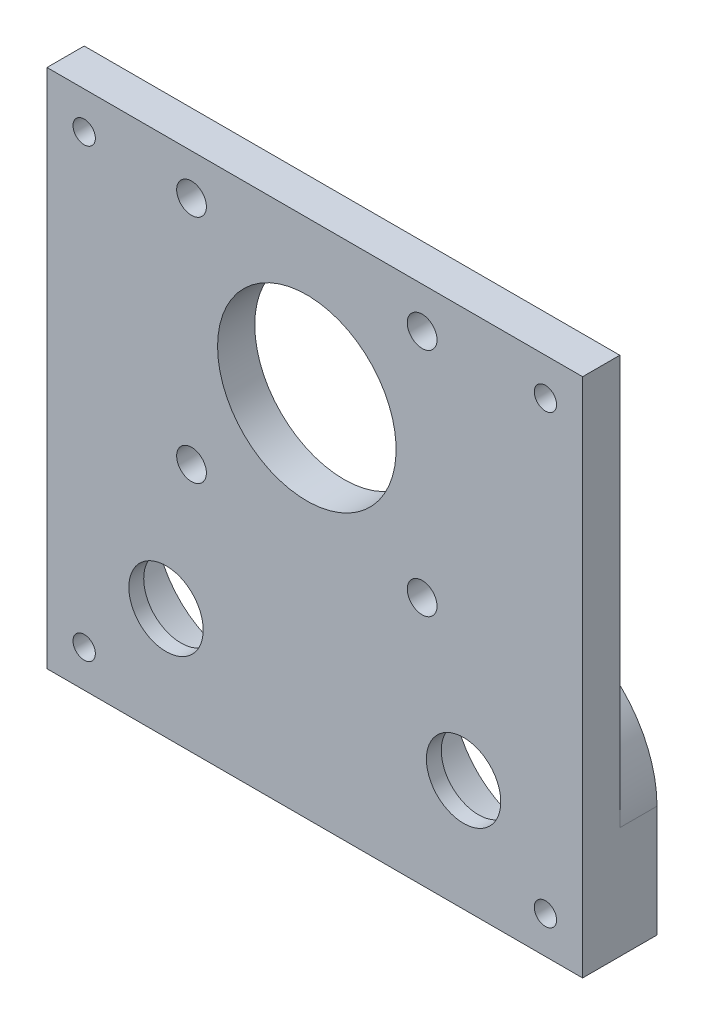
from build123d import *

# Parameters (mm, degrees)
SKETCH1_W               = 70
SKETCH1_H               = 70
BOSS_EXTRUDE1_DEPTH     = 10
SKETCH2_R               = 12
SKETCH2_R_2             = 2
SKETCH2_R_3             = 11.5
CUT_EXTRUDE1_DEPTH      = 10
SKETCH3_W               = 10
SKETCH3_H               = 70
BOSS_EXTRUDE2_DEPTH     = 15
SKETCH4_W               = 10
SKETCH4_H               = 70
BOSS_EXTRUDE3_DEPTH     = 15
SKETCH5_R               = 11.5
SKETCH5_R_2             = 4
BOSS_EXTRUDE4_DEPTH     = 2
SKETCH6_R               = 1.5
SKETCH6_R_2             = 1.648708122
CUT_EXTRUDE3_DEPTH      = 10
BOSS_EXTRUDE5_START     = -10
SKETCH7_R               = 11.986708095
SKETCH7_R_2             = 2
BOSS_EXTRUDE5_DEPTH     = 10
SKETCH8_R               = 12
CUT_EXTRUDE4_DEPTH      = 10
SKETCH9_R               = 2
CUT_EXTRUDE5_DEPTH      = 10
CUT_EXTRUDE7_DEPTH      = 5
SKETCH15_W              = 14
SKETCH15_H              = 70
CUT_EXTRUDE8_DEPTH      = 5
CUT_EXTRUDE9_DEPTH      = 19
CUT_EXTRUDE9_DEPTH_BACK = 48
SKETCH16_R              = 1.5
SKETCH17_R              = 5
CUT_EXTRUDE10_DEPTH     = 19
SKETCH18_R              = 16.289174866
SKETCH18_R_2            = 12
BOSS_EXTRUDE6_DEPTH     = 5


with BuildPart() as part:
    # Sketch1 → Boss-Extrude1 (new body)
    with BuildSketch(Plane.XY):
        with Locations((35, 35)):
            Rectangle(SKETCH1_W, SKETCH1_H)
    extrude(amount=BOSS_EXTRUDE1_DEPTH)

    # Sketch2 → Cut-Extrude1 (cut)
    with BuildSketch(Plane.XY.offset(10)):
        with Locations((35, 49)):
            Circle(SKETCH2_R)
        with Locations((19.5, 65)):
            Circle(SKETCH2_R_2)
        with Locations((50.5, 65)):
            Circle(SKETCH2_R_2)
        with Locations((19.5, 34)):
            Circle(SKETCH2_R_2)
        with Locations((50.5, 34)):
            Circle(SKETCH2_R_2)
        with Locations((15, 15)):
            Circle(SKETCH2_R_3)
        with Locations((55, 15)):
            Circle(SKETCH2_R_3)
    extrude(amount=-CUT_EXTRUDE1_DEPTH, mode=Mode.SUBTRACT)

    # Sketch3 → Boss-Extrude2 (add)
    with BuildSketch(Plane.ZY):
        with Locations((5, 35)):
            Rectangle(SKETCH3_W, SKETCH3_H)
    extrude(amount=BOSS_EXTRUDE2_DEPTH)

    # Sketch4 → Boss-Extrude3 (add)
    with BuildSketch(Plane(origin=(70, 0, 0), x_dir=(0, 0, -1), z_dir=(1, 0, 0))):
        with Locations((-5, 35)):
            Rectangle(SKETCH4_W, SKETCH4_H)
    extrude(amount=BOSS_EXTRUDE3_DEPTH)

    # Sketch5 → Boss-Extrude4 (add)
    # profile 1 of 2: a face of its own
    with BuildSketch(Plane.XY.offset(10)):
        with Locations((15, 15)):
            Circle(SKETCH5_R)
        with Locations((15, 15)):
            Circle(SKETCH5_R_2, mode=Mode.SUBTRACT)
    # profile 2 of 2: a face of its own
    with BuildSketch(Plane.XY.offset(10)):
        with Locations((55, 15)):
            Circle(SKETCH5_R)
        with Locations((55, 15)):
            Circle(SKETCH5_R_2, mode=Mode.SUBTRACT)
    extrude(amount=-BOSS_EXTRUDE4_DEPTH)

    # Sketch6 → Cut-Extrude3 (cut)
    with BuildSketch(Plane(origin=(0, 0, 0), x_dir=(-1, 0, 0), z_dir=(0, 0, -1))):
        with Locations((-80, 65)):
            Circle(SKETCH6_R)
        with Locations((-80, 5)):
            Circle(SKETCH6_R)
        with Locations((10, 65)):
            Circle(SKETCH6_R_2)
        with Locations((10, 5)):
            Circle(SKETCH6_R)
    extrude(amount=-CUT_EXTRUDE3_DEPTH, mode=Mode.SUBTRACT)

    # Sketch7 → Boss-Extrude5 (add)
    with BuildSketch(Plane(origin=(0, 0, 0), x_dir=(-1, 0, 0), z_dir=(0, 0, -1)).offset(BOSS_EXTRUDE5_START)):
        with Locations((-35, 49)):
            Circle(SKETCH7_R)
        with Locations((-50.5, 65)):
            Circle(SKETCH7_R_2)
        with Locations((-19.5, 65)):
            Circle(SKETCH7_R_2)
        with Locations((-19.5, 34)):
            Circle(SKETCH7_R_2)
        with Locations((-50.5, 34)):
            Circle(SKETCH7_R_2)
    extrude(amount=BOSS_EXTRUDE5_DEPTH)


with BuildPart() as boss_extrude5_piece_1:
    # of the separate pieces the step leaves, piece 1, a body of its own (boss_extrude5_pieces)
    add(part.part.solids().sort_by_distance((-15, 0, 0))[0])


with BuildPart() as boss_extrude5_piece_2:
    # of the separate pieces the step leaves, piece 2, a body of its own (boss_extrude5_pieces)
    add(part.part.solids().sort_by_distance((23.013291905, 49, 10))[0])


with BuildPart() as cut_extrude4_tool:
    # Sketch8 → Cut-Extrude4 (new body)
    with BuildSketch(Plane(origin=(0, 0, 0), x_dir=(-1, 0, 0), z_dir=(0, 0, -1))):
        with Locations((-33.928692494, 49)):
            Circle(SKETCH8_R)
    extrude(amount=-CUT_EXTRUDE4_DEPTH)


with BuildPart() as boss_extrude5_piece_1_1:
    add(boss_extrude5_piece_1.part)

    # Cut-Extrude4: cut by cut_extrude4_tool
    add(cut_extrude4_tool.part, mode=Mode.SUBTRACT)

    # Sketch9 → Cut-Extrude5 (cut)
    with BuildSketch(Plane(origin=(0, 0, 0), x_dir=(-1, 0, 0), z_dir=(0, 0, -1))):
        with Locations((-49.428692494, 64.5)):
            Circle(SKETCH9_R)
        with Locations((-49.428692494, 33.5)):
            Circle(SKETCH9_R)
        with Locations((-18.428692494, 33.5)):
            Circle(SKETCH9_R)
        with Locations((-18.428692494, 64.5)):
            Circle(SKETCH9_R)
    extrude(amount=-CUT_EXTRUDE5_DEPTH, mode=Mode.SUBTRACT)


with BuildPart() as boss_extrude5_piece_2_1:
    add(boss_extrude5_piece_2.part)

    # Cut-Extrude4: cut by cut_extrude4_tool
    add(cut_extrude4_tool.part, mode=Mode.SUBTRACT)


with BuildPart() as cut_extrude7_tool:
    # Sketch14 → Cut-Extrude7 (new body)
    with BuildSketch(Plane(origin=(0, 0, 0), x_dir=(-1, 0, 0), z_dir=(0, 0, -1))):
        with BuildLine():
            Line((-85, 0), (-85, 70))
            Line((-85, 70), (15, 70))
            Line((15, 70), (15, 0))
            Line((15, 0), (1, 0))
            Line((1, 0), (1, 15))
            ThreePointArc((1, 15), (-15, 31), (-31, 15))
            Line((-31, 15), (-31, 0))
            Line((-31, 0), (-39, 0))
            Line((-39, 0), (-39, 15))
            ThreePointArc((-39, 15), (-55, 31), (-71, 15))
            Line((-71, 15), (-71, 0))
            Line((-71, 0), (-85, 0))
        make_face()
    extrude(amount=-CUT_EXTRUDE7_DEPTH)


with BuildPart() as boss_extrude5_piece_1_2:
    add(boss_extrude5_piece_1_1.part)

    # Cut-Extrude7: cut by cut_extrude7_tool
    add(cut_extrude7_tool.part, mode=Mode.SUBTRACT)

    # Sketch15 → Cut-Extrude8 (cut)
    with BuildSketch(Plane(origin=(0, 0, 5), x_dir=(-1, 0, 0), z_dir=(0, 0, -1))):
        with Locations((-78, 35)):
            Rectangle(SKETCH15_W, SKETCH15_H)
        with Locations((8, 35)):
            Rectangle(SKETCH15_W, SKETCH15_H)
    extrude(amount=-CUT_EXTRUDE8_DEPTH, mode=Mode.SUBTRACT)

    # Sketch16 → Cut-Extrude9 (cut, two sides: drawn at the far end of the back side and taken through both)
    with BuildSketch(Plane(origin=(0, 0, 5), x_dir=(-1, 0, 0), z_dir=(0, 0, -1)).offset(-CUT_EXTRUDE9_DEPTH_BACK)):
        with Locations((-66, 65)):
            Circle(SKETCH16_R)
        with Locations((-66, 5)):
            Circle(SKETCH16_R)
        with Locations((-4, 5)):
            Circle(SKETCH16_R)
        with Locations((-4, 65)):
            Circle(SKETCH16_R)
    extrude(amount=CUT_EXTRUDE9_DEPTH + CUT_EXTRUDE9_DEPTH_BACK, mode=Mode.SUBTRACT)

    # Sketch17 → Cut-Extrude10 (cut)
    with BuildSketch(Plane(origin=(0, 0, 8), x_dir=(-1, 0, 0), z_dir=(0, 0, -1))):
        with Locations((-15, 15)):
            Circle(SKETCH17_R)
        with Locations((-55, 15)):
            Circle(SKETCH17_R)
    extrude(amount=-CUT_EXTRUDE10_DEPTH, mode=Mode.SUBTRACT)



with BuildPart() as boss_extrude5_piece_2_2:
    add(boss_extrude5_piece_2_1.part)

    # Cut-Extrude7: cut by cut_extrude7_tool
    add(cut_extrude7_tool.part, mode=Mode.SUBTRACT)


with BuildPart() as boss_extrude5_piece_1_3:
    add(boss_extrude5_piece_1_2.part)

    add(boss_extrude5_piece_2_2.part)  # Boss-Extrude6 merges Boss-Extrude5 piece 2
    # Sketch18 → Boss-Extrude6 (add)
    with BuildSketch(Plane(origin=(0, 0, 5), x_dir=(-1, 0, 0), z_dir=(0, 0, -1))):
        with Locations((-33.928692494, 49)):
            Circle(SKETCH18_R)
        with Locations((-33.928692494, 49)):
            Circle(SKETCH18_R_2, mode=Mode.SUBTRACT)
    extrude(amount=-BOSS_EXTRUDE6_DEPTH)


solid = boss_extrude5_piece_1_3.part
